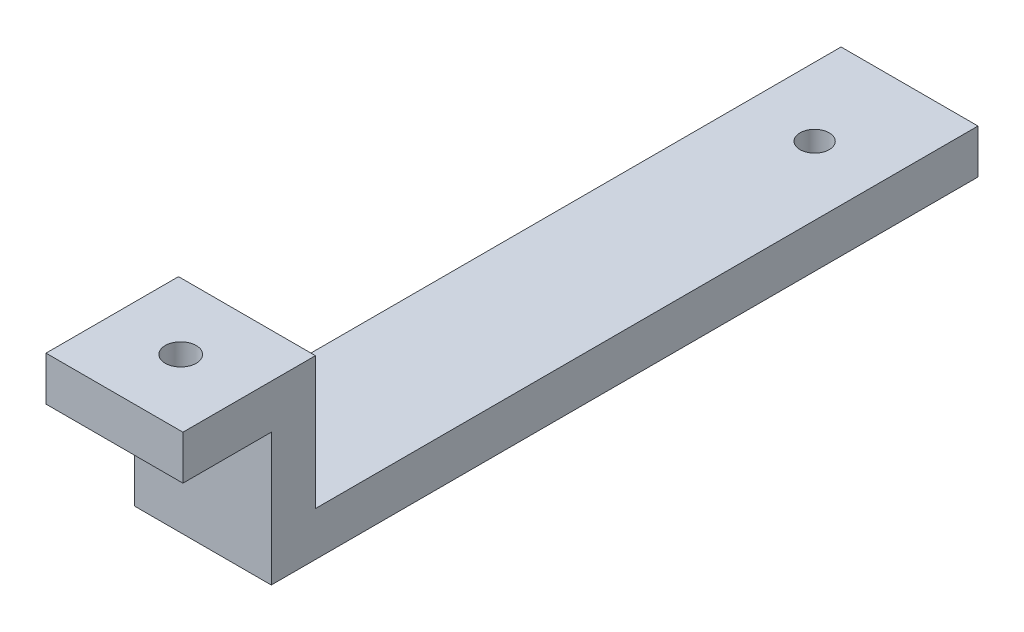
from build123d import *

# Parameters (mm, degrees)
EXTRUDE_THIN1_DEPTH = 31
SKETCH6_R           = 3.5
CUT_EXTRUDE1_DEPTH  = 10
SKETCH7_R           = 3.302
CUT_EXTRUDE3_DEPTH  = 10.16


with BuildPart() as part:
    # Sketch1 → Extrude-Thin1 (new body)
    with BuildSketch(Plane(origin=(0, 0, 0), x_dir=(0, 0, -1), z_dir=(1, 0, 0))):
        Polygon((0, 0), (30, 0), (30, -29.972), (180, -29.972), (180, -39.972), (20, -39.972), (20, -10), (0, -10), align=None)
    extrude(amount=EXTRUDE_THIN1_DEPTH)

    # Sketch6 → Cut-Extrude1 (cut)
    with BuildSketch(Plane(origin=(0, 0, 0), x_dir=(1, 0, 0), z_dir=(0, 1, 0))):
        with Locations(Location((15.5, 15, 0), (0, 0, 270))):
            Circle(SKETCH6_R)
    extrude(amount=-CUT_EXTRUDE1_DEPTH, mode=Mode.SUBTRACT)

    # Sketch7 → Cut-Extrude3 (cut)
    with BuildSketch(Plane(origin=(0, -29.972, 0), x_dir=(1, 0, 0), z_dir=(0, 1, 0))):
        with Locations(Location((15.494, 158.524, 0), (0, 0, 270))):
            Circle(SKETCH7_R)
    extrude(amount=-CUT_EXTRUDE3_DEPTH, mode=Mode.SUBTRACT)


solid = part.part
